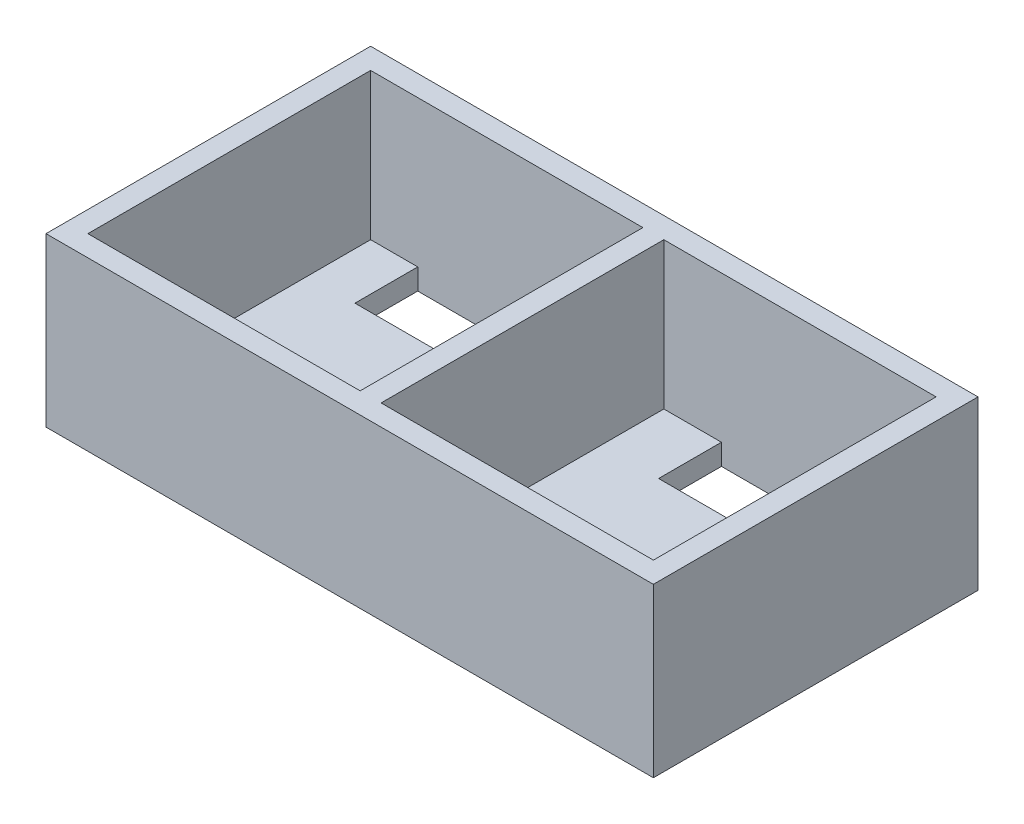
from build123d import *

# Parameters (mm, degrees)
SKETCH1_W           = 29
SKETCH1_H           = 15.5
BOSS_EXTRUDE1_DEPTH = 8
SHELL1_T            = -1
SKETCH2_W           = 1
SKETCH2_H           = 13.5
BOSS_EXTRUDE2_DEPTH = 7
SKETCH3_W           = 8
SKETCH3_H           = 3
CUT_EXTRUDE1_DEPTH  = 7


with BuildPart() as part:
    # Sketch1 → Boss-Extrude1 (new body)
    with BuildSketch(Plane(origin=(0, 0, 0), x_dir=(1, 0, 0), z_dir=(0, 1, 0))):
        Rectangle(SKETCH1_W, SKETCH1_H)
    extrude(amount=BOSS_EXTRUDE1_DEPTH)

    # Shell1
    shell1_openings = [part.faces().sort_by_distance(p)[0] for p in [
        (0, 8, 0),
    ]]
    offset(amount=SHELL1_T, openings=shell1_openings, kind=Kind.INTERSECTION)

    # Sketch2 → Boss-Extrude2 (add)
    with BuildSketch(Plane(origin=(0, 1, 0), x_dir=(1, 0, 0), z_dir=(0, 1, 0))):
        Rectangle(SKETCH2_W, SKETCH2_H)
    extrude(amount=BOSS_EXTRUDE2_DEPTH)

    # Sketch3 → Cut-Extrude1 (cut)
    with BuildSketch(Plane(origin=(0, 1, 0), x_dir=(1, 0, 0), z_dir=(0, 1, 0))):
        with Locations((-7.25, 5.25)):
            Rectangle(SKETCH3_W, SKETCH3_H)
        with Locations((7.25, 5.25)):
            Rectangle(SKETCH3_W, SKETCH3_H)
        with Locations((7.25, -5.25)):
            Rectangle(SKETCH3_W, SKETCH3_H)
        with Locations((-7.25, -5.25)):
            Rectangle(SKETCH3_W, SKETCH3_H)
    extrude(amount=-CUT_EXTRUDE1_DEPTH, mode=Mode.SUBTRACT)


solid = part.part
